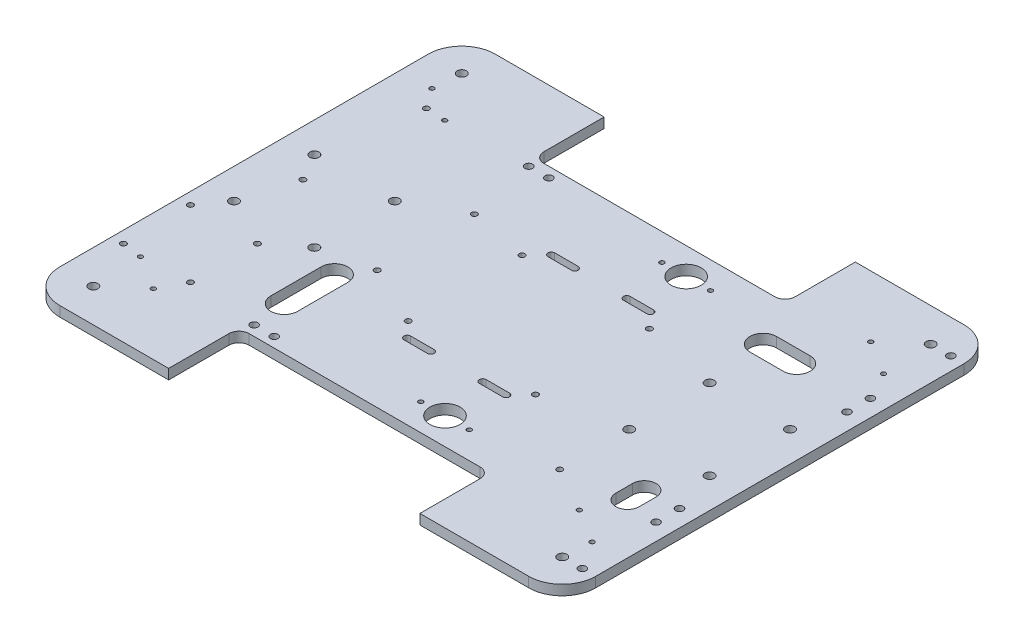
from build123d import *

# Parameters (mm, degrees)
PLATE_DEPTH                      = 6
CUT_DECKPOSTS_M5_DEPTH           = 207.242575624
CUT_DECKPOSTS_M5_DEPTH_BACK      = 207.242575624
SK_DECKPOSTS_M5_R                = 2.75
CUT_CASTERMOUNTS_M5_DEPTH        = 207.242575624
CUT_CASTERMOUNTS_M5_DEPTH_BACK   = 207.242575624
SK_CASTERMOUNTS_M5_R             = 2.75
CUT_SPRINGHOLES_18_DEPTH         = 207.242575624
CUT_SPRINGHOLES_18_DEPTH_BACK    = 207.242575624
SK_SPRINGHOLES_18_R              = 9
CUT_SPRINGCUPS_M2P5_DEPTH        = 207.242575624
CUT_SPRINGCUPS_M2P5_DEPTH_BACK   = 207.242575624
SK_SPRINGCUPS_M2P5_R             = 1.35
CUT_PIVOTHANGERS_M4_DEPTH        = 207.242575624
CUT_PIVOTHANGERS_M4_DEPTH_BACK   = 207.242575624
SK_PIVOTHANGERS_M4_R             = 2.25
CUT_BATTERYTRAY_M3_DEPTH         = 207.242575624
CUT_BATTERYTRAY_M3_DEPTH_BACK    = 207.242575624
SK_BATTERYTRAY_M3_R              = 1.7
CUT_BATTERYSTRAPS_DEPTH          = 207.242575624
CUT_BATTERYSTRAPS_DEPTH_BACK     = 207.242575624
CUT_POWERBOARD_M3_DEPTH          = 207.242575624
CUT_POWERBOARD_M3_DEPTH_BACK     = 207.242575624
SK_POWERBOARD_M3_R               = 1.7
CUT_MOTORDRIVER_M3_DEPTH         = 207.242575624
CUT_MOTORDRIVER_M3_DEPTH_BACK    = 207.242575624
SK_MOTORDRIVER_M3_R              = 1.7
CUT_SPLICES_M3_DEPTH             = 207.242575624
CUT_SPLICES_M3_DEPTH_BACK        = 207.242575624
SK_SPLICES_M3_R                  = 1.7
CUT_CHARGECONTACTS_M4_DEPTH      = 207.242575624
CUT_CHARGECONTACTS_M4_DEPTH_BACK = 207.242575624
SK_CHARGECONTACTS_M4_R           = 2.25
CUT_BUMPER_M4_DEPTH              = 207.242575624
CUT_BUMPER_M4_DEPTH_BACK         = 207.242575624
SK_BUMPER_M4_R                   = 2.25
CUT_CLIFFSENSORS_M2P5_DEPTH      = 207.242575624
CUT_CLIFFSENSORS_M2P5_DEPTH_BACK = 207.242575624
SK_CLIFFSENSORS_M2P5_R           = 1.35
CUT_FUSEF2_M3_DEPTH              = 207.242575624
CUT_FUSEF2_M3_DEPTH_BACK         = 207.242575624
SK_FUSEF2_M3_R                   = 1.7
CUT_PASSTHROUGHS_DEPTH           = 207.242575624
CUT_PASSTHROUGHS_DEPTH_BACK      = 207.242575624


with BuildPart() as part:
    # SK_Outline → Plate (new body)
    with BuildSketch(Plane(origin=(0, 0, 0), x_dir=(1, 0, 0), z_dir=(0, 1, 0))):
        with BuildLine():
            Line((160, -110), (160, 110))
            ThreePointArc((160, 110), (154.142135624, 124.142135624), (140, 130))
            Line((140, 130), (75, 130))
            Line((75, 130), (75, 94))
            ThreePointArc((75, 94), (73.242640687, 89.757359313), (69, 88))
            Line((69, 88), (-69, 88))
            ThreePointArc((-69, 88), (-73.242640687, 89.757359313), (-75, 94))
            Line((-75, 94), (-75, 130))
            Line((-75, 130), (-140, 130))
            ThreePointArc((-140, 130), (-154.142135624, 124.142135624), (-160, 110))
            Line((-160, 110), (-160, -110))
            ThreePointArc((-160, -110), (-154.142135624, -124.142135624), (-140, -130))
            Line((-140, -130), (-75, -130))
            Line((-75, -130), (-75, -94))
            ThreePointArc((-75, -94), (-73.242640687, -89.757359313), (-69, -88))
            Line((-69, -88), (69, -88))
            ThreePointArc((69, -88), (73.242640687, -89.757359313), (75, -94))
            Line((75, -94), (75, -130))
            Line((75, -130), (140, -130))
            ThreePointArc((140, -130), (154.142135624, -124.142135624), (160, -110))
        make_face()
    extrude(amount=PLATE_DEPTH)

    # SK_DeckPosts_M5 → Cut_DeckPosts_M5 (cut, two sides: drawn at the far end of the back side and taken through both)
    with BuildSketch(Plane(origin=(0, 0, 0), x_dir=(1, 0, 0), z_dir=(0, 1, 0)).offset(-CUT_DECKPOSTS_M5_DEPTH_BACK)):
        with Locations(Location((140, -110, 0), (0, 0, 270))):
            Circle(SK_DECKPOSTS_M5_R)
        with Locations(Location((140, 110, 0), (0, 0, 270))):
            Circle(SK_DECKPOSTS_M5_R)
        with Locations(Location((-140, -110, 0), (0, 0, 270))):
            Circle(SK_DECKPOSTS_M5_R)
        with Locations(Location((-140, 110, 0), (0, 0, 270))):
            Circle(SK_DECKPOSTS_M5_R)
    extrude(amount=CUT_DECKPOSTS_M5_DEPTH + CUT_DECKPOSTS_M5_DEPTH_BACK, mode=Mode.SUBTRACT)

    # SK_CasterMounts_M5 → Cut_CasterMounts_M5 (cut, two sides: drawn at the far end of the back side and taken through both)
    with BuildSketch(Plane(origin=(0, 0, 0), x_dir=(1, 0, 0), z_dir=(0, 1, 0)).offset(-CUT_CASTERMOUNTS_M5_DEPTH_BACK)):
        with Locations(Location((94, 24, 0), (0, 0, 270))):
            Circle(SK_CASTERMOUNTS_M5_R)
        with Locations(Location((94, -24, 0), (0, 0, 270))):
            Circle(SK_CASTERMOUNTS_M5_R)
        with Locations(Location((142, 24, 0), (0, 0, 270))):
            Circle(SK_CASTERMOUNTS_M5_R)
        with Locations(Location((142, -24, 0), (0, 0, 270))):
            Circle(SK_CASTERMOUNTS_M5_R)
        with Locations(Location((-142, 24, 0), (0, 0, 270))):
            Circle(SK_CASTERMOUNTS_M5_R)
        with Locations(Location((-142, -24, 0), (0, 0, 270))):
            Circle(SK_CASTERMOUNTS_M5_R)
        with Locations(Location((-94, 24, 0), (0, 0, 270))):
            Circle(SK_CASTERMOUNTS_M5_R)
        with Locations(Location((-94, -24, 0), (0, 0, 270))):
            Circle(SK_CASTERMOUNTS_M5_R)
    extrude(amount=CUT_CASTERMOUNTS_M5_DEPTH + CUT_CASTERMOUNTS_M5_DEPTH_BACK, mode=Mode.SUBTRACT)

    # SK_SpringHoles_18 → Cut_SpringHoles_18 (cut, two sides: drawn at the far end of the back side and taken through both)
    with BuildSketch(Plane(origin=(0, 0, 0), x_dir=(1, 0, 0), z_dir=(0, 1, 0)).offset(-CUT_SPRINGHOLES_18_DEPTH_BACK)):
        with Locations(Location((32, -72, 0), (0, 0, 270))):
            Circle(SK_SPRINGHOLES_18_R)
        with Locations(Location((32, 72, 0), (0, 0, 270))):
            Circle(SK_SPRINGHOLES_18_R)
    extrude(amount=CUT_SPRINGHOLES_18_DEPTH + CUT_SPRINGHOLES_18_DEPTH_BACK, mode=Mode.SUBTRACT)

    # SK_SpringCups_M2p5 → Cut_SpringCups_M2p5 (cut, two sides: drawn at the far end of the back side and taken through both)
    with BuildSketch(Plane(origin=(0, 0, 0), x_dir=(1, 0, 0), z_dir=(0, 1, 0)).offset(-CUT_SPRINGCUPS_M2P5_DEPTH_BACK)):
        with Locations(Location((17.5, -72, 0), (0, 0, 270))):
            Circle(SK_SPRINGCUPS_M2P5_R)
        with Locations(Location((46.5, -72, 0), (0, 0, 270))):
            Circle(SK_SPRINGCUPS_M2P5_R)
        with Locations(Location((17.5, 72, 0), (0, 0, 270))):
            Circle(SK_SPRINGCUPS_M2P5_R)
        with Locations(Location((46.5, 72, 0), (0, 0, 270))):
            Circle(SK_SPRINGCUPS_M2P5_R)
    extrude(amount=CUT_SPRINGCUPS_M2P5_DEPTH + CUT_SPRINGCUPS_M2P5_DEPTH_BACK, mode=Mode.SUBTRACT)

    # SK_PivotHangers_M4 → Cut_PivotHangers_M4 (cut, two sides: drawn at the far end of the back side and taken through both)
    with BuildSketch(Plane(origin=(0, 0, 0), x_dir=(1, 0, 0), z_dir=(0, 1, 0)).offset(-CUT_PIVOTHANGERS_M4_DEPTH_BACK)):
        with Locations(Location((-72, -82, 0), (0, 0, 270))):
            Circle(SK_PIVOTHANGERS_M4_R)
        with Locations(Location((-60, -82, 0), (0, 0, 270))):
            Circle(SK_PIVOTHANGERS_M4_R)
        with Locations(Location((-72, 82, 0), (0, 0, 270))):
            Circle(SK_PIVOTHANGERS_M4_R)
        with Locations(Location((-60, 82, 0), (0, 0, 270))):
            Circle(SK_PIVOTHANGERS_M4_R)
    extrude(amount=CUT_PIVOTHANGERS_M4_DEPTH + CUT_PIVOTHANGERS_M4_DEPTH_BACK, mode=Mode.SUBTRACT)

    # SK_BatteryTray_M3 → Cut_BatteryTray_M3 (cut, two sides: drawn at the far end of the back side and taken through both)
    with BuildSketch(Plane(origin=(0, 0, 0), x_dir=(1, 0, 0), z_dir=(0, 1, 0)).offset(-CUT_BATTERYTRAY_M3_DEPTH_BACK)):
        with Locations(Location((-28, -34, 0), (0, 0, 270))):
            Circle(SK_BATTERYTRAY_M3_R)
        with Locations(Location((-28, 34, 0), (0, 0, 270))):
            Circle(SK_BATTERYTRAY_M3_R)
        with Locations(Location((48, -34, 0), (0, 0, 270))):
            Circle(SK_BATTERYTRAY_M3_R)
        with Locations(Location((48, 34, 0), (0, 0, 270))):
            Circle(SK_BATTERYTRAY_M3_R)
    extrude(amount=CUT_BATTERYTRAY_M3_DEPTH + CUT_BATTERYTRAY_M3_DEPTH_BACK, mode=Mode.SUBTRACT)

    # SK_BatteryStraps → Cut_BatteryStraps (cut, two sides: drawn at the far end of the back side and taken through both)
    with BuildSketch(Plane(origin=(0, 0, 0), x_dir=(1, 0, 0), z_dir=(0, 1, 0)).offset(-CUT_BATTERYSTRAPS_DEPTH_BACK)):
        with BuildLine():
            Line((-19.5, -41), (-5.5, -41))
            ThreePointArc((-5.5, -41), (-3.5, -43), (-5.5, -45))
            Line((-5.5, -45), (-19.5, -45))
            ThreePointArc((-19.5, -45), (-21.5, -43), (-19.5, -41))
        make_face()
        with BuildLine():
            Line((-19.5, 45), (-5.5, 45))
            ThreePointArc((-5.5, 45), (-3.5, 43), (-5.5, 41))
            Line((-5.5, 41), (-19.5, 41))
            ThreePointArc((-19.5, 41), (-21.5, 43), (-19.5, 45))
        make_face()
        with BuildLine():
            Line((25.5, -41), (39.5, -41))
            ThreePointArc((39.5, -41), (41.5, -43), (39.5, -45))
            Line((39.5, -45), (25.5, -45))
            ThreePointArc((25.5, -45), (23.5, -43), (25.5, -41))
        make_face()
        with BuildLine():
            Line((25.5, 45), (39.5, 45))
            ThreePointArc((39.5, 45), (41.5, 43), (39.5, 41))
            Line((39.5, 41), (25.5, 41))
            ThreePointArc((25.5, 41), (23.5, 43), (25.5, 45))
        make_face()
    extrude(amount=CUT_BATTERYSTRAPS_DEPTH + CUT_BATTERYSTRAPS_DEPTH_BACK, mode=Mode.SUBTRACT)

    # SK_PowerBoard_M3 → Cut_PowerBoard_M3 (cut, two sides: drawn at the far end of the back side and taken through both)
    with BuildSketch(Plane(origin=(0, 0, 0), x_dir=(1, 0, 0), z_dir=(0, 1, 0)).offset(-CUT_POWERBOARD_M3_DEPTH_BACK)):
        with Locations(Location((-132.5, 81.35, 0), (0, 0, 270))):
            Circle(SK_POWERBOARD_M3_R)
        with Locations(Location((-132.5, 7.65, 0), (0, 0, 270))):
            Circle(SK_POWERBOARD_M3_R)
    extrude(amount=CUT_POWERBOARD_M3_DEPTH + CUT_POWERBOARD_M3_DEPTH_BACK, mode=Mode.SUBTRACT)

    # SK_MotorDriver_M3 → Cut_MotorDriver_M3 (cut, two sides: drawn at the far end of the back side and taken through both)
    with BuildSketch(Plane(origin=(0, 0, 0), x_dir=(1, 0, 0), z_dir=(0, 1, 0)).offset(-CUT_MOTORDRIVER_M3_DEPTH_BACK)):
        with Locations(Location((-153, -39, 0), (0, 0, 270))):
            Circle(SK_MOTORDRIVER_M3_R)
        with Locations(Location((-153, -79, 0), (0, 0, 270))):
            Circle(SK_MOTORDRIVER_M3_R)
        with Locations(Location((-113, -39, 0), (0, 0, 270))):
            Circle(SK_MOTORDRIVER_M3_R)
        with Locations(Location((-113, -79, 0), (0, 0, 270))):
            Circle(SK_MOTORDRIVER_M3_R)
    extrude(amount=CUT_MOTORDRIVER_M3_DEPTH + CUT_MOTORDRIVER_M3_DEPTH_BACK, mode=Mode.SUBTRACT)

    # SK_Splices_M3 → Cut_Splices_M3 (cut, two sides: drawn at the far end of the back side and taken through both)
    with BuildSketch(Plane(origin=(0, 0, 0), x_dir=(1, 0, 0), z_dir=(0, 1, 0)).offset(-CUT_SPLICES_M3_DEPTH_BACK)):
        with Locations(Location((-63.5, 41, 0), (0, 0, 270))):
            Circle(SK_SPLICES_M3_R)
        with Locations(Location((-63.5, -17, 0), (0, 0, 270))):
            Circle(SK_SPLICES_M3_R)
    extrude(amount=CUT_SPLICES_M3_DEPTH + CUT_SPLICES_M3_DEPTH_BACK, mode=Mode.SUBTRACT)

    # SK_ChargeContacts_M4 → Cut_ChargeContacts_M4 (cut, two sides: drawn at the far end of the back side and taken through both)
    with BuildSketch(Plane(origin=(0, 0, 0), x_dir=(1, 0, 0), z_dir=(0, 1, 0)).offset(-CUT_CHARGECONTACTS_M4_DEPTH_BACK)):
        with Locations(Location((150, -50, 0), (0, 0, 270))):
            Circle(SK_CHARGECONTACTS_M4_R)
        with Locations(Location((150, -64, 0), (0, 0, 270))):
            Circle(SK_CHARGECONTACTS_M4_R)
        with Locations(Location((150, 50, 0), (0, 0, 270))):
            Circle(SK_CHARGECONTACTS_M4_R)
        with Locations(Location((150, 64, 0), (0, 0, 270))):
            Circle(SK_CHARGECONTACTS_M4_R)
    extrude(amount=CUT_CHARGECONTACTS_M4_DEPTH + CUT_CHARGECONTACTS_M4_DEPTH_BACK, mode=Mode.SUBTRACT)

    # SK_Bumper_M4 → Cut_Bumper_M4 (cut, two sides: drawn at the far end of the back side and taken through both)
    with BuildSketch(Plane(origin=(0, 0, 0), x_dir=(1, 0, 0), z_dir=(0, 1, 0)).offset(-CUT_BUMPER_M4_DEPTH_BACK)):
        with Locations(Location((152, -110, 0), (0, 0, 270))):
            Circle(SK_BUMPER_M4_R)
        with Locations(Location((152, 110, 0), (0, 0, 270))):
            Circle(SK_BUMPER_M4_R)
    extrude(amount=CUT_BUMPER_M4_DEPTH + CUT_BUMPER_M4_DEPTH_BACK, mode=Mode.SUBTRACT)

    # SK_CliffSensors_M2p5 → Cut_CliffSensors_M2p5 (cut, two sides: drawn at the far end of the back side and taken through both)
    with BuildSketch(Plane(origin=(0, 0, 0), x_dir=(1, 0, 0), z_dir=(0, 1, 0)).offset(-CUT_CLIFFSENSORS_M2P5_DEPTH_BACK)):
        with Locations(Location((120.84, -80.65, 0), (0, 0, 270))):
            Circle(SK_CLIFFSENSORS_M2P5_R)
        with Locations(Location((141.16, -93.35, 0), (0, 0, 270))):
            Circle(SK_CLIFFSENSORS_M2P5_R)
        with Locations(Location((120.84, 93.35, 0), (0, 0, 270))):
            Circle(SK_CLIFFSENSORS_M2P5_R)
        with Locations(Location((141.16, 80.65, 0), (0, 0, 270))):
            Circle(SK_CLIFFSENSORS_M2P5_R)
        with Locations(Location((-141.16, -80.65, 0), (0, 0, 270))):
            Circle(SK_CLIFFSENSORS_M2P5_R)
        with Locations(Location((-120.84, -93.35, 0), (0, 0, 270))):
            Circle(SK_CLIFFSENSORS_M2P5_R)
        with Locations(Location((-141.16, 93.35, 0), (0, 0, 270))):
            Circle(SK_CLIFFSENSORS_M2P5_R)
        with Locations(Location((-120.84, 80.65, 0), (0, 0, 270))):
            Circle(SK_CLIFFSENSORS_M2P5_R)
    extrude(amount=CUT_CLIFFSENSORS_M2P5_DEPTH + CUT_CLIFFSENSORS_M2P5_DEPTH_BACK, mode=Mode.SUBTRACT)

    # SK_FuseF2_M3 → Cut_FuseF2_M3 (cut, two sides: drawn at the far end of the back side and taken through both)
    with BuildSketch(Plane(origin=(0, 0, 0), x_dir=(1, 0, 0), z_dir=(0, 1, 0)).offset(-CUT_FUSEF2_M3_DEPTH_BACK)):
        with Locations(Location((94, -65.5, 0), (0, 0, 270))):
            Circle(SK_FUSEF2_M3_R)
    extrude(amount=CUT_FUSEF2_M3_DEPTH + CUT_FUSEF2_M3_DEPTH_BACK, mode=Mode.SUBTRACT)

    # SK_PassThroughs → Cut_PassThroughs (cut, two sides: drawn at the far end of the back side and taken through both)
    with BuildSketch(Plane(origin=(0, 0, 0), x_dir=(1, 0, 0), z_dir=(0, 1, 0)).offset(-CUT_PASSTHROUGHS_DEPTH_BACK)):
        with BuildLine():
            Line((-66, -32), (-66, -62))
            ThreePointArc((-66, -62), (-74, -70), (-82, -62))
            Line((-82, -62), (-82, -32))
            ThreePointArc((-82, -32), (-74, -24), (-66, -32))
        make_face()
        with BuildLine():
            Line((90, 68), (110, 68))
            ThreePointArc((110, 68), (118, 60), (110, 52))
            Line((110, 52), (90, 52))
            ThreePointArc((90, 52), (82, 60), (90, 68))
        make_face()
        with BuildLine():
            Line((137, -51), (137, -61))
            ThreePointArc((137, -61), (130, -68), (123, -61))
            Line((123, -61), (123, -51))
            ThreePointArc((123, -51), (130, -44), (137, -51))
        make_face()
    extrude(amount=CUT_PASSTHROUGHS_DEPTH + CUT_PASSTHROUGHS_DEPTH_BACK, mode=Mode.SUBTRACT)


solid = part.part
